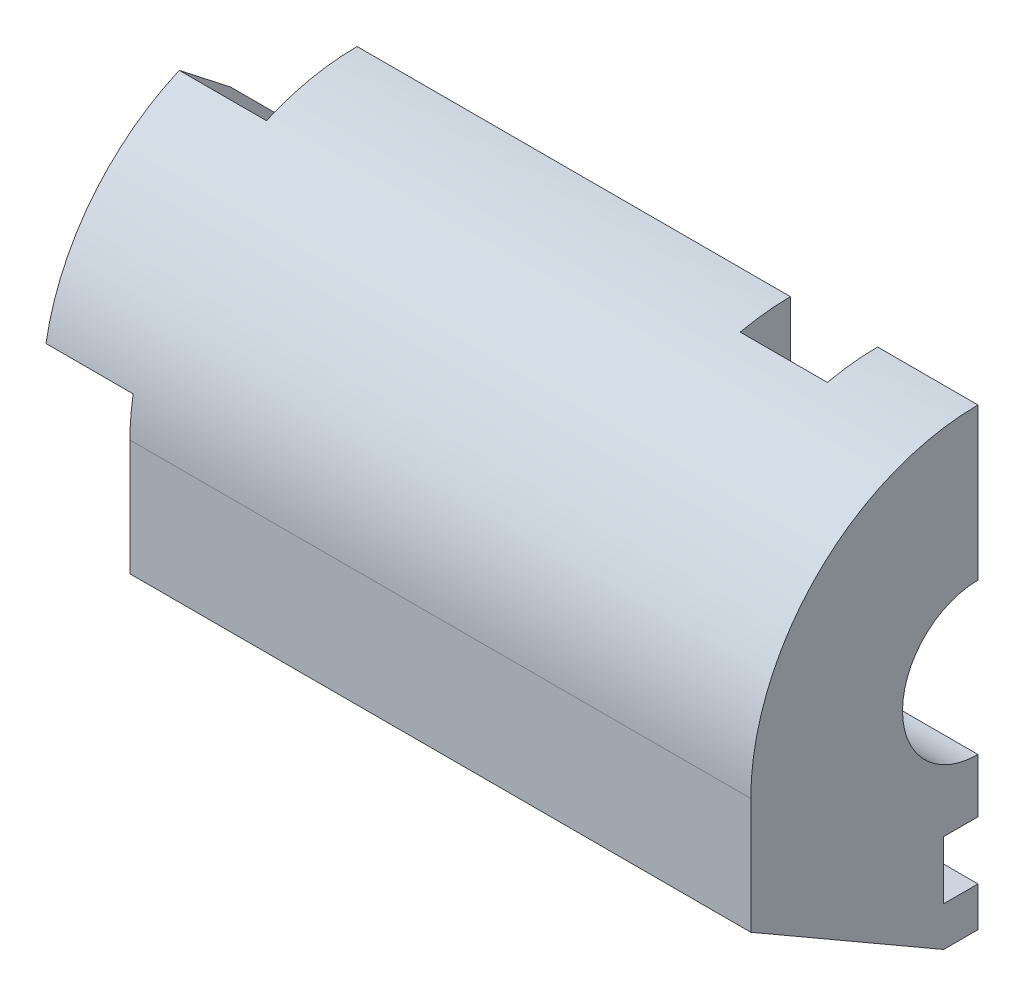
from build123d import *

# Parameters (mm, degrees)
BOSS_EXTRU_1_DEPTH      = 235
ESQUISSE2_R             = 28.575
ENL_V_MAT_EXTRU_1_DEPTH = 235
ESQUISSE3_R             = 44.45
ENL_V_MAT_EXTRU_2_DEPTH = 78
ESQUISSE4_W             = 33
ESQUISSE4_H             = 61.631350579
ENL_V_MAT_EXTRU_3_DEPTH = 19
ENL_V_MAT_EXTRU_4_DEPTH = 13
BOSS_EXTRU_2_START      = -33
BOSS_EXTRU_2_DEPTH      = 33


with BuildPart() as part:
    # Esquisse1 → Boss.-Extru.1 (new body)
    with BuildSketch(Plane(origin=(0, 0, 0), x_dir=(0, 0, -1), z_dir=(1, 0, 0))):
        with BuildLine():
            Line((0, 0), (0, 86))
            ThreePointArc((0, 86), (-60.811183182, 60.811183182), (-86, 0))
            Line((-86, 0), (-86, -43.853430349))
            Line((-86, -43.853430349), (-13, -86))
            Line((-13, -86), (0, -86))
            Line((0, -86), (0, 0))
        make_face()
    extrude(amount=BOSS_EXTRU_1_DEPTH)

    # Esquisse2 → Enlèv. mat.-Extru.1 (cut)
    with BuildSketch(Plane(origin=(0, 0, 0), x_dir=(0, 0, -1), z_dir=(1, 0, 0))):
        Circle(ESQUISSE2_R)
    extrude(amount=ENL_V_MAT_EXTRU_1_DEPTH, mode=Mode.SUBTRACT)

    # Esquisse3 → Enlèv. mat.-Extru.2 (cut)
    with BuildSketch(Plane(origin=(0, 0, 0), x_dir=(0, 0, -1), z_dir=(1, 0, 0))):
        Circle(ESQUISSE3_R)
    extrude(amount=ENL_V_MAT_EXTRU_2_DEPTH, mode=Mode.SUBTRACT)

    # Esquisse4 → Enlèv. mat.-Extru.3 (cut)
    with BuildSketch(Plane.XY):
        with Locations((180.5, 55.184324711)):
            Rectangle(ESQUISSE4_W, ESQUISSE4_H)
    extrude(amount=ENL_V_MAT_EXTRU_3_DEPTH, mode=Mode.SUBTRACT)

    # Esquisse5 → Enlèv. mat.-Extru.4 (cut)
    with BuildSketch(Plane.XY):
        with BuildLine():
            ThreePointArc((125, -71), (114, -60), (125, -49))
            Line((125, -49), (235, -49))
            Line((235, -49), (235, -71))
            Line((235, -71), (125, -71))
        make_face()
    extrude(amount=ENL_V_MAT_EXTRU_4_DEPTH, mode=Mode.SUBTRACT)

    # Esquisse6 → Boss.-Extru.2 (add)
    with BuildSketch(Plane(origin=(0, 0, 0), x_dir=(0, 0, -1), z_dir=(1, 0, 0)).offset(BOSS_EXTRU_2_START)):
        with BuildLine():
            Line((-65.430668922, -0.909705656), (-40.188548434, 31.398735242))
            Line((-40.188548434, 31.398735242), (-14.946427946, 63.707176139))
            Line((-14.946427946, 63.707176139), (-34.329616239, 78.850982549))
            ThreePointArc((-34.329616239, 78.850982549), (-67.683027015, 53.056647596), (-84.767274524, 14.508934135))
            Line((-84.767274524, 14.508934135), (-65.430668922, -0.909705656))
        make_face()
    extrude(amount=BOSS_EXTRU_2_DEPTH)


solid = part.part
